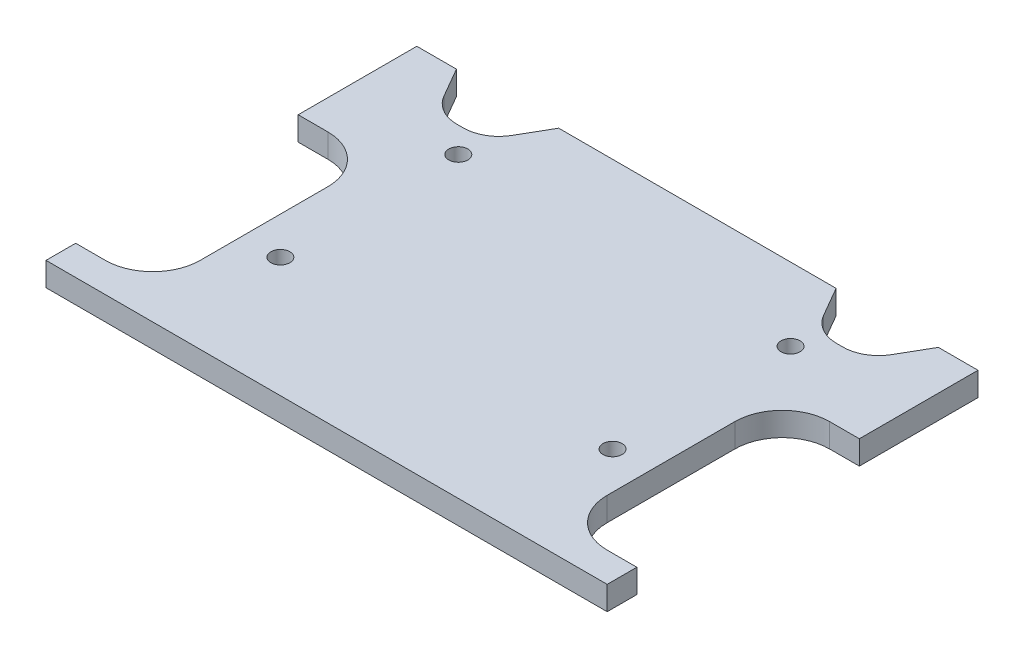
from build123d import *

# Parameters (mm, degrees)
BOSS_EXTRUDE1_DEPTH    = 6.35
F_10_CLEARANCE_HOLE1_D = 5.1054


with BuildPart() as part:
    # Sketch1 → Boss-Extrude1 (new body)
    with BuildSketch(Plane(origin=(0, 0, 0), x_dir=(1, 0, 0), z_dir=(0, 1, 0))):
        with BuildLine():
            Line((-54.448, -16.667265757), (-54.448, -50.812890909))
            ThreePointArc((-54.448, -50.812890909), (-58.167743879, -59.79314703), (-67.148, -63.512890909))
            Line((-67.148, -63.512890909), (-75.0855, -63.512890909))
            Line((-75.0855, -63.512890909), (-75.0855, -71.450390909))
            Line((-75.0855, -71.450390909), (75.0855, -71.450390909))
            Line((75.0855, -71.450390909), (75.0855, -63.512890909))
            Line((75.0855, -63.512890909), (67.148, -63.512890909))
            ThreePointArc((67.148, -63.512890909), (58.167743879, -59.79314703), (54.448, -50.812890909))
            Line((54.448, -50.812890909), (54.448, -16.667265757))
            ThreePointArc((54.448, -16.667265757), (58.167743879, -7.687009636), (67.148, -3.967265757))
            Line((67.148, -3.967265757), (75.0855, -3.967265757))
            Line((75.0855, -3.967265757), (75.0855, 27.782734243))
            Line((75.0855, 27.782734243), (64.482348419, 27.782734243))
            Line((64.482348419, 27.782734243), (59.899630657, 19.845234243))
            ThreePointArc((59.899630657, 19.845234243), (56.413238686, 16.358842272), (51.650738686, 15.082734243))
            Line((51.650738686, 15.082734243), (49.949261314, 15.082734243))
            ThreePointArc((49.949261314, 15.082734243), (45.186761314, 16.358842272), (41.700369343, 19.845234243))
            Line((41.700369343, 19.845234243), (37.117651581, 27.782734243))
            Line((37.117651581, 27.782734243), (-37.117651581, 27.782734243))
            Line((-37.117651581, 27.782734243), (-41.700369343, 19.845234243))
            ThreePointArc((-41.700369343, 19.845234243), (-45.186761314, 16.358842272), (-49.949261314, 15.082734243))
            Line((-49.949261314, 15.082734243), (-51.650738686, 15.082734243))
            ThreePointArc((-51.650738686, 15.082734243), (-56.413238686, 16.358842272), (-59.899630657, 19.845234243))
            Line((-59.899630657, 19.845234243), (-64.482348419, 27.782734243))
            Line((-64.482348419, 27.782734243), (-75.0855, 27.782734243))
            Line((-75.0855, 27.782734243), (-75.0855, -3.967265757))
            Line((-75.0855, -3.967265757), (-67.148, -3.967265757))
            ThreePointArc((-67.148, -3.967265757), (-58.167743879, -7.687009636), (-54.448, -16.667265757))
        make_face()
    extrude(amount=BOSS_EXTRUDE1_DEPTH)

    # #10 Clearance Hole1 (through all)
    with Locations(Plane(origin=(0, 6.35, 0), x_dir=(1, 0, 0), z_dir=(0, 1, 0))):
        with Locations((-44.449999955, 8.251852655), (-44.449999955, -39.373147345), (44.450000045, 8.251852655), (44.450000045, -39.373147345)):
            Hole(F_10_CLEARANCE_HOLE1_D / 2)


solid = part.part
